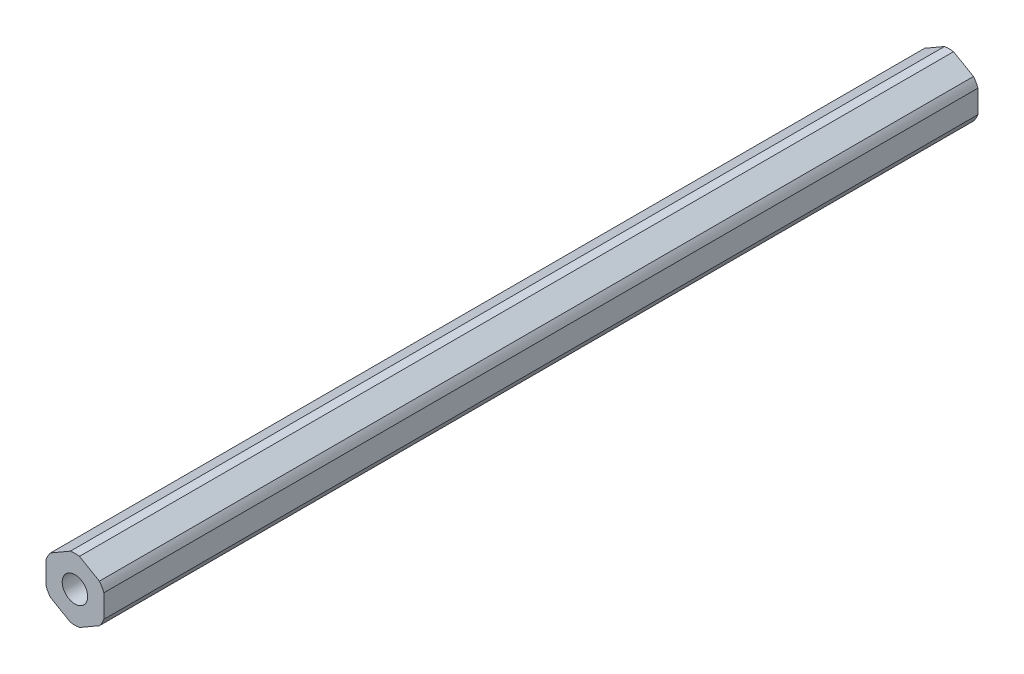
from build123d import *

# Parameters (mm, degrees)
SHAFT_BOSS_DEPTH                = 457.2
SKETCH2_R                       = 7.66445
SKETCH2_R_2                     = 5.12445
CUT_FOR_THUNDER_HEX_ROUND_DEPTH = 914.4
SKETCH3_R                       = 2.0955
CENTER_HOLE_CUT_DEPTH           = 914.4


with BuildPart() as part:
    # Sketch1 → Shaft Boss (new, symmetric)
    with BuildSketch(Plane.XY):
        Polygon((0, 5.499261314), (-4.7625, 2.749630657), (-4.7625, -2.749630657), (0, -5.499261314), (4.7625, -2.749630657), (4.7625, 2.749630657), align=None)
    extrude(amount=SHAFT_BOSS_DEPTH, both=True)

    # Sketch2 → Cut For Thunder Hex Round (cut)
    with BuildSketch(Plane(origin=(0, 0, -457.2), x_dir=(-1, 0, 0), z_dir=(0, 0, -1))):
        Circle(SKETCH2_R)
        Circle(SKETCH2_R_2, mode=Mode.SUBTRACT)
    extrude(amount=-CUT_FOR_THUNDER_HEX_ROUND_DEPTH, mode=Mode.SUBTRACT)

    # Sketch3 → Center Hole Cut (cut)
    with BuildSketch(Plane(origin=(0, 0, -457.2), x_dir=(-1, 0, 0), z_dir=(0, 0, -1))):
        Circle(SKETCH3_R)
    extrude(amount=-CENTER_HOLE_CUT_DEPTH, mode=Mode.SUBTRACT)

    # SurfaceCut1
    split(bisect_by=Plane(origin=(0, 0, 71.9105), x_dir=(-1, 0, 0), z_dir=(0, 0, -1)), keep=Keep.TOP)

    # SurfaceCut2
    split(bisect_by=Plane.XY.offset(-71.9105), keep=Keep.TOP)


solid = part.part
